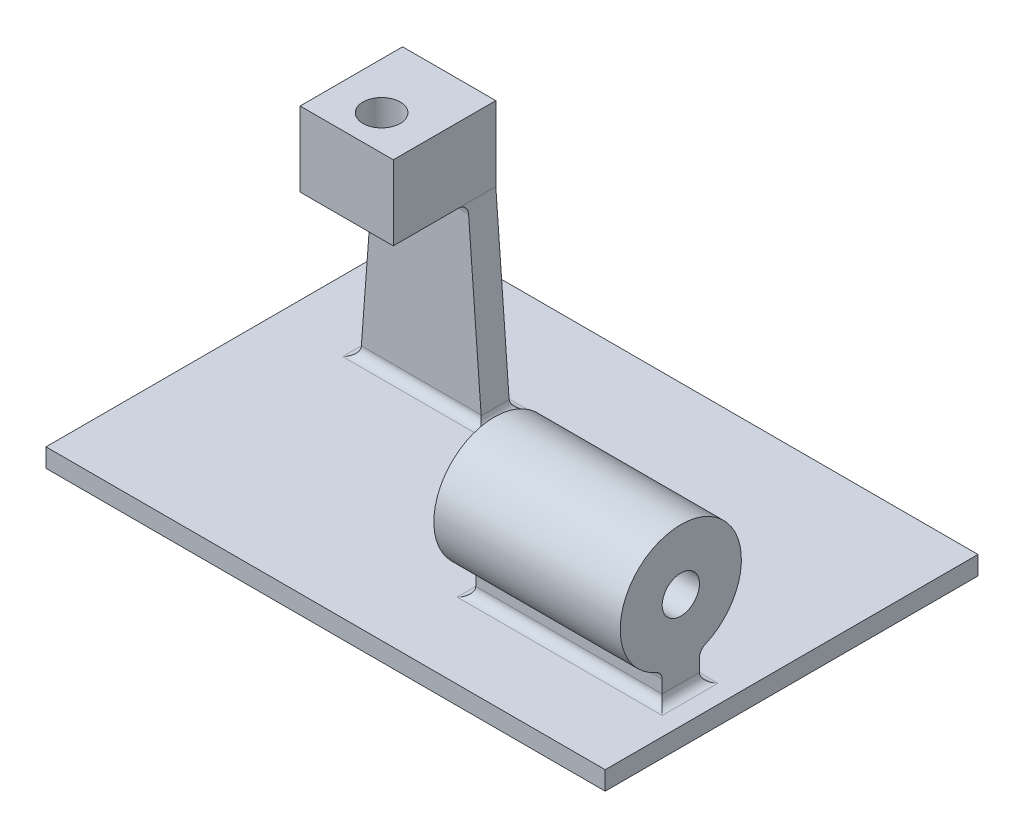
from build123d import *

# Parameters (mm, degrees)
SKETCH1_W           = 60
SKETCH1_H           = 40
BOSS_EXTRUDE1_DEPTH = 2
SKETCH4_W           = 10
SKETCH4_H           = 3
BOSS_EXTRUDE2_DEPTH = 8
SKETCH6_W           = 10
SKETCH6_H           = 8
BOSS_EXTRUDE5_DEPTH = 8
SKETCH8_R           = 2
CUT_EXTRUDE2_DEPTH  = 8
SKETCH9_W           = 20
SKETCH9_H           = 4
BOSS_EXTRUDE6_DEPTH = 4
SKETCH10_R          = 6.5
SKETCH10_R_2        = 2
BOSS_EXTRUDE7_DEPTH = 20
FILLET1_R           = 1
FILLET2_R           = 1
FILLET3_R           = 1


with BuildPart() as part:
    # Sketch1 → Boss-Extrude1 (new body)
    with BuildSketch(Plane(origin=(0, 0, 0), x_dir=(1, 0, 0), z_dir=(0, 1, 0))):
        Rectangle(SKETCH1_W, SKETCH1_H)
    extrude(amount=BOSS_EXTRUDE1_DEPTH)

    # Sketch3 → Loft1 section 0
    with BuildSketch(Plane(origin=(0, 22, 0), x_dir=(1, 0, 0), z_dir=(0, 1, 0))):
        with BuildLine():
            Line((-20.040616465, 5.303560218), (-10.040616465, 5.303560218))
            Line((-10.040616465, 5.303560218), (-10.040616465, 8.303560218))
            Line((-10.040616465, 8.303560218), (-20.040616465, 8.303560218))
            Line((-20.040616465, 8.303560218), (-20.040616465, 5.303560218))
        make_face()
    # Sketch2 → Loft1 section 1
    with BuildSketch(Plane(origin=(0, 2, 0), x_dir=(1, 0, 0), z_dir=(0, 1, 0))):
        with BuildLine():
            Line((-21.540616465, 5.303560218), (-8.540616465, 5.303560218))
            Line((-8.540616465, 5.303560218), (-8.540616465, 8.303560218))
            Line((-8.540616465, 8.303560218), (-21.540616465, 8.303560218))
            Line((-21.540616465, 8.303560218), (-21.540616465, 5.303560218))
        make_face()
    loft()

    # Sketch4 → Boss-Extrude2 (add)
    with BuildSketch(Plane(origin=(0, 22, 0), x_dir=(1, 0, 0), z_dir=(0, 1, 0))):
        with Locations((-15.040616465, 6.803560218)):
            Rectangle(SKETCH4_W, SKETCH4_H)
    extrude(amount=BOSS_EXTRUDE2_DEPTH)

    # Sketch6 → Boss-Extrude5 (add)
    with BuildSketch(Plane.XY.offset(-5.303560218)):
        with Locations((-15.040616465, 26)):
            Rectangle(SKETCH6_W, SKETCH6_H)
    extrude(amount=BOSS_EXTRUDE5_DEPTH)

    # Sketch8 → Cut-Extrude2 (cut)
    with BuildSketch(Plane(origin=(0, 30, 0), x_dir=(1, 0, 0), z_dir=(0, 1, 0))):
        with Locations(Location((-15.040616465, 1.048838028, 0), (0, 0, 270))):
            Circle(SKETCH8_R)
    extrude(amount=-CUT_EXTRUDE2_DEPTH, mode=Mode.SUBTRACT)

    # Sketch9 → Boss-Extrude6 (add)
    with BuildSketch(Plane(origin=(0, 2, 0), x_dir=(1, 0, 0), z_dir=(0, 1, 0))):
        with Locations((17.019567568, -8.907492708)):
            Rectangle(SKETCH9_W, SKETCH9_H)
    extrude(amount=BOSS_EXTRUDE6_DEPTH)

    # Sketch10 → Boss-Extrude7 (add)
    with BuildSketch(Plane(origin=(27.019567568, 0, 0), x_dir=(0, 0, -1), z_dir=(1, 0, 0))):
        with Locations((-8.907492708, 11.238036321)):
            Circle(SKETCH10_R)
        with Locations((-8.907492708, 11.238036321)):
            Circle(SKETCH10_R_2, mode=Mode.SUBTRACT)
    extrude(amount=-BOSS_EXTRUDE7_DEPTH)

    # Fillet1
    fillet1_edges = [part.edges().sort_by_distance(p)[0] for p in [
        (-21.540616465, 2, -6.803560218),
        (-15.040616465, 2, -5.303560218),
        (-15.040616465, 2, -8.303560218),
        (-8.540616465, 2, -6.803560218),
    ]]
    fillet(fillet1_edges, radius=FILLET1_R)

    # Fillet2
    fillet2_edges = [part.edges().sort_by_distance(p)[0] for p in [
        (-15.040616465, 22, -5.303560218),
    ]]
    fillet(fillet2_edges, radius=FILLET2_R)

    # Fillet3
    fillet3_edges = [part.edges().sort_by_distance(p)[0] for p in [
        (17.019567568, 2, 10.907492708),
        (27.019567568, 2, 8.907492708),
        (7.019567568, 2, 8.907492708),
        (17.019567568, 2, 6.907492708),
        (17.019567568, 5.053377883, 6.907492708),
        (17.019567568, 5.053377883, 10.907492708),
    ]]
    fillet(fillet3_edges, radius=FILLET3_R)


solid = part.part
